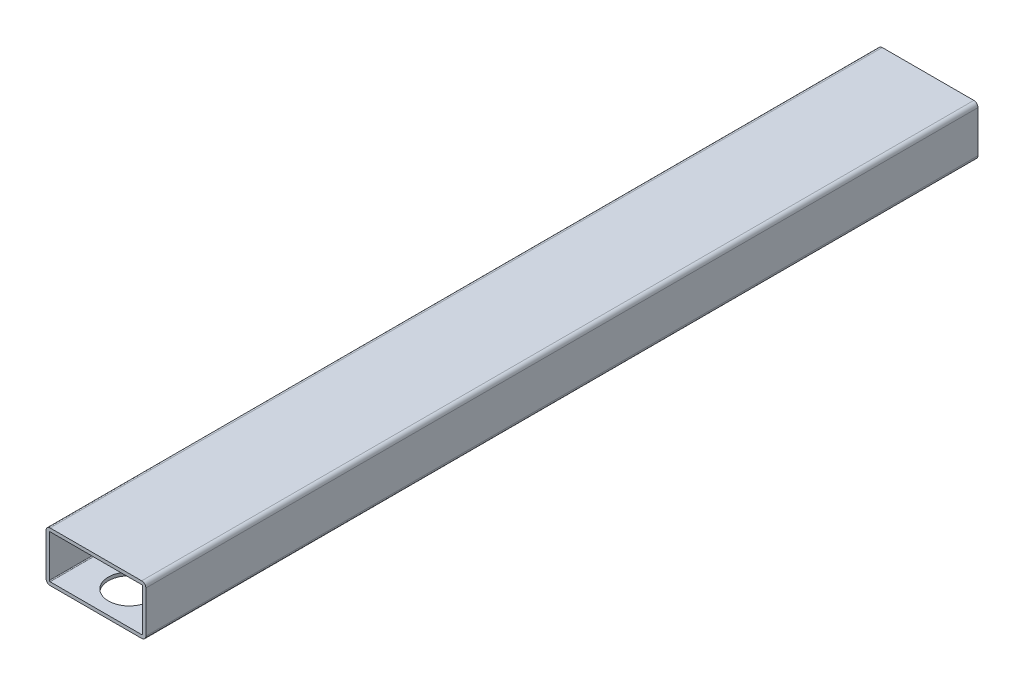
from build123d import *

# Parameters (mm, degrees)
EXTRUDE_1_DEPTH     = 1000
CUT_EXTRUDE_1_REACH = 1005.594
SKETCH_2_R          = 25


with BuildPart() as part:
    # 草图1 → 凸台-拉伸1 (new body)
    with BuildSketch(Plane.XY):
        with BuildLine():
            Line((-55, 30), (55, 30))
            ThreePointArc((55, 30), (58.535533906, 28.535533906), (60, 25))
            Line((60, 25), (60, -25))
            ThreePointArc((60, -25), (58.535533906, -28.535533906), (55, -30))
            Line((55, -30), (-55, -30))
            ThreePointArc((-55, -30), (-58.535533906, -28.535533906), (-60, -25))
            Line((-60, -25), (-60, 25))
            ThreePointArc((-60, 25), (-58.535533906, 28.535533906), (-55, 30))
        make_face()
        with BuildLine():
            Line((-55, 26), (55, 26))
            ThreePointArc((55, 26), (55.707106781, 25.707106781), (56, 25))
            Line((56, 25), (56, -25))
            ThreePointArc((56, -25), (55.707106781, -25.707106781), (55, -26))
            Line((55, -26), (-55, -26))
            ThreePointArc((-55, -26), (-55.707106781, -25.707106781), (-56, -25))
            Line((-56, -25), (-56, 25))
            ThreePointArc((-56, 25), (-55.707106781, 25.707106781), (-55, 26))
        make_face(mode=Mode.SUBTRACT)
    extrude(amount=EXTRUDE_1_DEPTH)

    # 草图2 → 切除-拉伸1 (cut, up to next)
    with BuildSketch(Plane.XZ.offset(30), mode=Mode.PRIVATE) as cut_extrude_1_sk1:
        with Locations(Location((0, 960, 0), (0, 0, 270))):
            Circle(SKETCH_2_R)
    cut_extrude_1_tool1 = extrude(cut_extrude_1_sk1.sketch, amount=-CUT_EXTRUDE_1_REACH, mode=Mode.PRIVATE) & part.part
    add(cut_extrude_1_tool1.solids().sort_by_distance((0, -30, 960))[0], mode=Mode.SUBTRACT)


solid = part.part
